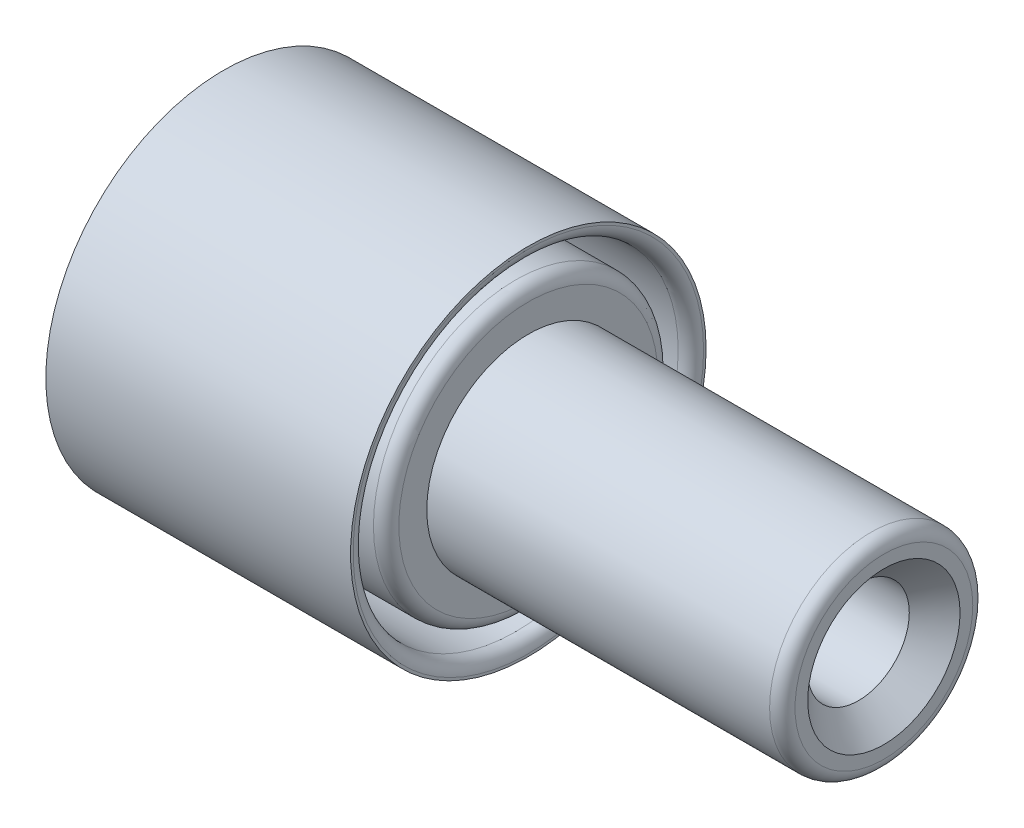
from build123d import *

# Parameters (mm, degrees)
SKETCH_1_R          = 7
EXTRUDE_1_DEPTH     = 12
SKETCH_2_R          = 6.4
SKETCH_2_R_2        = 5.6
CUT_EXTRUDE_1_DEPTH = 10
SKETCH_3_R          = 4
EXTRUDE_2_DEPTH     = 14
SKETCH_4_R          = 2
CUT_EXTRUDE_2_DEPTH = 28.820855486
CHAMFER_1_SIZE      = 1.5
CHAMFER_2_SIZE      = 1
FILLET_1_R          = 0.5


with BuildPart() as part:
    # 草图1 → 凸台-拉伸1 (new body)
    with BuildSketch(Plane(origin=(0, 0, 0), x_dir=(0, 0, -1), z_dir=(1, 0, 0))):
        Circle(SKETCH_1_R)
    extrude(amount=EXTRUDE_1_DEPTH)

    # 草图2 → 切除-拉伸1 (cut)
    with BuildSketch(Plane(origin=(12, 0, 0), x_dir=(0, 0, -1), z_dir=(1, 0, 0))):
        Circle(SKETCH_2_R)
        Circle(SKETCH_2_R_2, mode=Mode.SUBTRACT)
    extrude(amount=-CUT_EXTRUDE_1_DEPTH, mode=Mode.SUBTRACT)

    # 草图3 → 凸台-拉伸2 (add)
    with BuildSketch(Plane(origin=(12, 0, 0), x_dir=(0, 0, -1), z_dir=(1, 0, 0))):
        Circle(SKETCH_3_R)
    extrude(amount=EXTRUDE_2_DEPTH)

    # 草图4 → 切除-拉伸2 (cut, through all)
    with BuildSketch(Plane(origin=(26, 0, 0), x_dir=(0, 0, -1), z_dir=(1, 0, 0))):
        Circle(SKETCH_4_R)
    extrude(amount=-CUT_EXTRUDE_2_DEPTH, mode=Mode.SUBTRACT)

    # 倒角1
    chamfer_1_edges = [part.edges().sort_by_distance(p)[0] for p in [
        (0, 0, 2),
    ]]
    chamfer(chamfer_1_edges, length=CHAMFER_1_SIZE)

    # 倒角2
    chamfer_2_edges = [part.edges().sort_by_distance(p)[0] for p in [
        (26, 0, 2),
    ]]
    chamfer(chamfer_2_edges, length=CHAMFER_2_SIZE)

    # 圆角1
    fillet_1_edges = [part.edges().sort_by_distance(p)[0] for p in [
        (26, 0, 4),
        (12, 0, 5.6),
        (12, 0, 6.4),
    ]]
    fillet(fillet_1_edges, radius=FILLET_1_R)


solid = part.part
